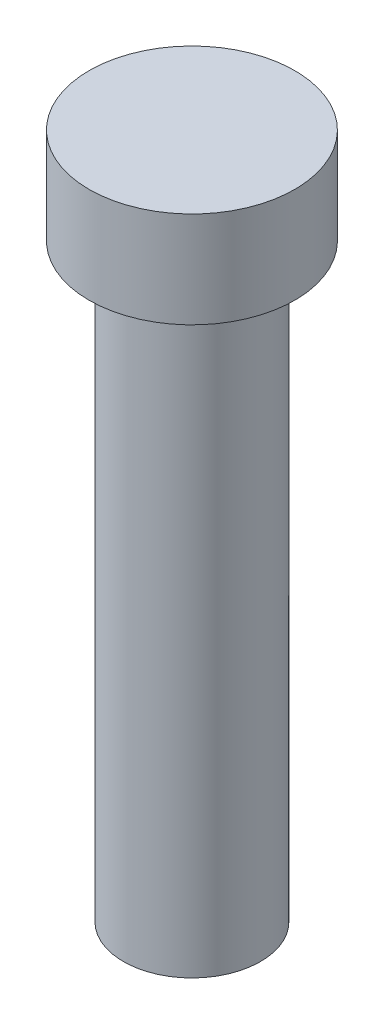
from build123d import *

# Parameters (mm, degrees)
SKETCH1_R           = 7.5
BOSS_EXTRUDE1_DEPTH = 7
SKETCH2_R           = 5
BOSS_EXTRUDE2_DEPTH = 43


with BuildPart() as part:
    # Sketch1 → Boss-Extrude1 (new body)
    with BuildSketch(Plane(origin=(0, 0, 0), x_dir=(1, 0, 0), z_dir=(0, 1, 0))):
        with Locations(Location((0, 0, 0), (0, 0, 270))):
            Circle(SKETCH1_R)
    extrude(amount=BOSS_EXTRUDE1_DEPTH)

    # Sketch2 → Boss-Extrude2 (add)
    with BuildSketch(Plane.XZ):
        with Locations(Location((0, 0, 0), (0, 0, 270))):
            Circle(SKETCH2_R)
    extrude(amount=BOSS_EXTRUDE2_DEPTH)


solid = part.part
